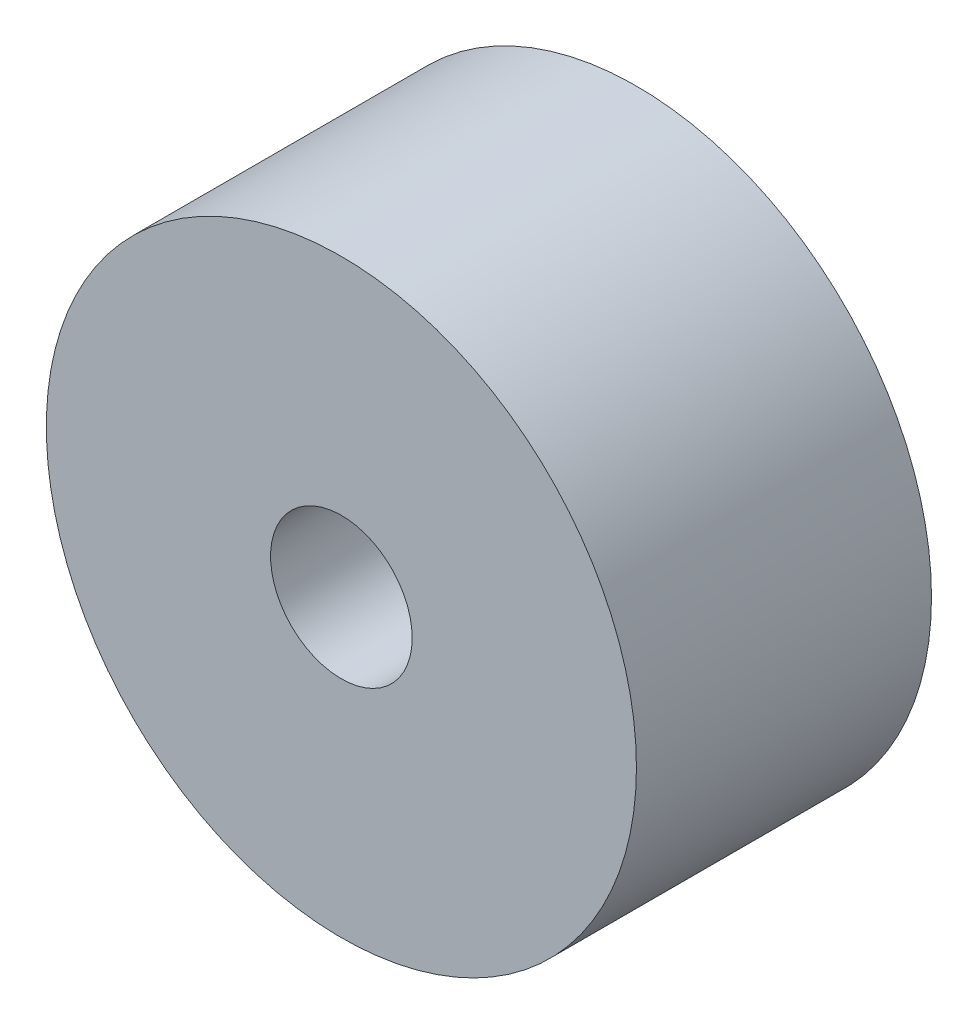
from build123d import *

# Parameters (mm, degrees)
SKETCH1_R           = 5
SKETCH1_R_2         = 1.2
BOSS_EXTRUDE1_DEPTH = 5


with BuildPart() as part:
    # Sketch1 → Boss-Extrude1 (new body)
    with BuildSketch(Plane.XY):
        Circle(SKETCH1_R)
        Circle(SKETCH1_R_2, mode=Mode.SUBTRACT)
    extrude(amount=BOSS_EXTRUDE1_DEPTH)


solid = part.part
